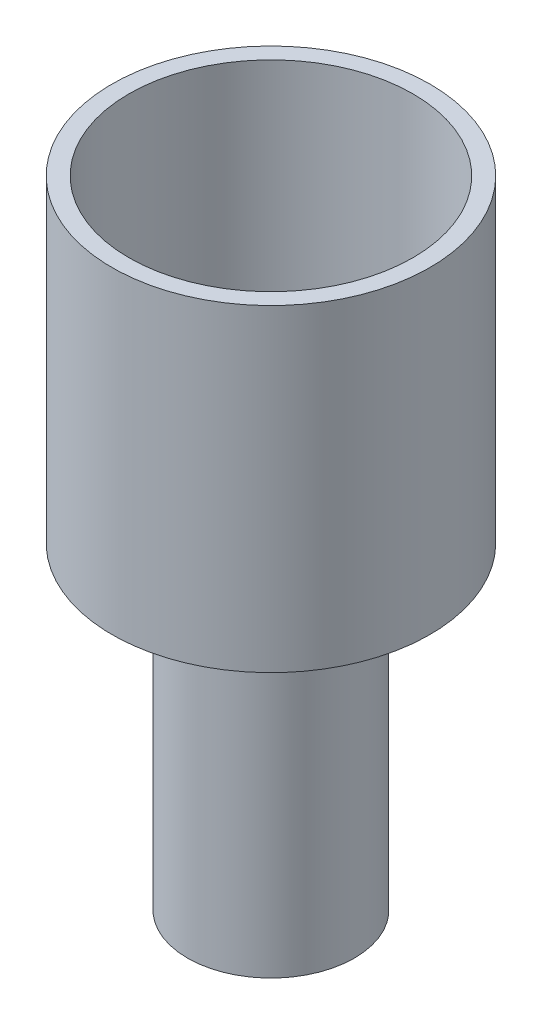
from build123d import *

# Parameters (mm, degrees)
SKETCH2_R                        = 9.525
SKETCH2_R_2                      = 5
BOSS_EXTRUDE1_DEPTH              = 19.05
SKETCH2_3_R                      = 5
BOSS_EXTRUDE2_DEPTH              = 19.05
F_11_32_0_34375_DIAMETER_HOLE1_D = 8.73125
SKETCH13_R                       = 8.509
CUT_EXTRUDE1_DEPTH               = 17.78


with BuildPart() as part:
    # Sketch2 → Boss-Extrude1 (new body)
    # profile 1 of 2: a face of its own
    with BuildSketch(Plane(origin=(0, 0, 0), x_dir=(1, 0, 0), z_dir=(0, 1, 0))):
        with Locations(Location((0, 0, 0), (0, 0, 90))):
            Circle(SKETCH2_R)
        Circle(SKETCH2_R_2, mode=Mode.SUBTRACT)
    # profile 2 of 2: a face of its own
    with BuildSketch(Plane(origin=(0, 0, 0), x_dir=(1, 0, 0), z_dir=(0, 1, 0))):
        Circle(SKETCH2_R_2)
    extrude(amount=BOSS_EXTRUDE1_DEPTH)

    # Sketch2<3> → Boss-Extrude2 (add)
    with BuildSketch(Plane(origin=(0, 0, 0), x_dir=(1, 0, 0), z_dir=(0, 1, 0))):
        with Locations(Location((0, 0, 0), (0, 0, 270))):
            Circle(SKETCH2_3_R)
    extrude(amount=-BOSS_EXTRUDE2_DEPTH)

    # 11/32 (0.34375) Diameter Hole1 (through all)
    with Locations(Plane(origin=(0, -19.05, 0), x_dir=(-1, 0, 0), z_dir=(0, -1, 0))):
        with Locations((0, 0)):
            Hole(F_11_32_0_34375_DIAMETER_HOLE1_D / 2)

    # Sketch13 → Cut-Extrude1 (cut)
    with BuildSketch(Plane(origin=(0, 19.05, 0), x_dir=(1, 0, 0), z_dir=(0, 1, 0))):
        with Locations(Location((0, 0, 0), (0, 0, 270))):
            Circle(SKETCH13_R)
    extrude(amount=-CUT_EXTRUDE1_DEPTH, mode=Mode.SUBTRACT)


solid = part.part
